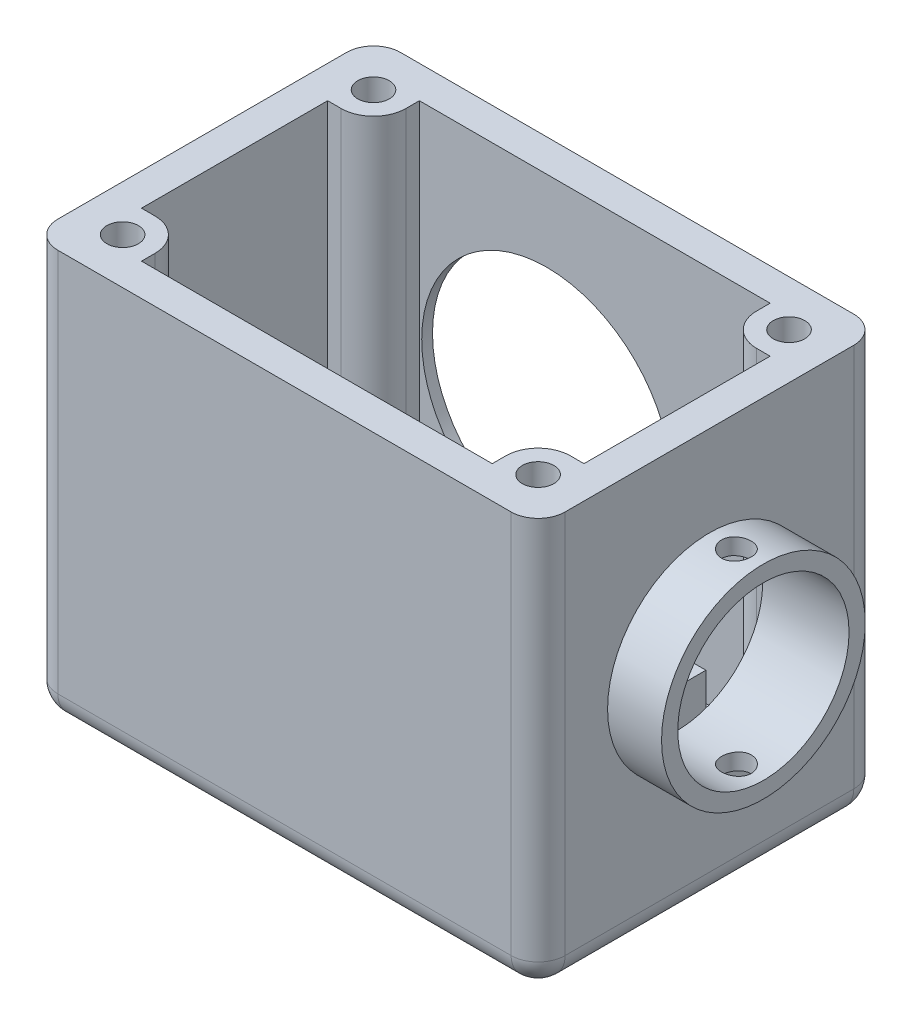
from build123d import *

# Parameters (mm, degrees)
SKETCH1_W                 = 94
SKETCH1_H                 = 63.5
BOSS_EXTRUDE1_DEPTH       = 76.2
SKETCH2_W                 = 82.000024
SKETCH2_H                 = 51.500024
CUT_EXTRUDE1_DEPTH        = 70.2
SKETCH7_R                 = 33
CUT_EXTRUDE4_DEPTH        = 4
SKETCH8_R                 = 12.55
CUT_EXTRUDE5_DEPTH        = 2
SKETCH15_W                = 72
SKETCH15_H                = 25
BOSS_EXTRUDE3_DEPTH       = 22
FILLET1_R                 = 5
BOSS_EXTRUDE4_DEPTH       = 70.2
F_1_0MM_DOWEL_HOLE2_D     = 5.85
F_1_0MM_DOWEL_HOLE2_DEPTH = 10.75
F_1_0MM_DOWEL_HOLE2_TIP   = 1.757517311
SKETCH49_R                = 15.875
CUT_EXTRUDE7_DEPTH        = 5.999988
BOSS_EXTRUDE5_START       = 10
SKETCH51_R                = 18.875
SKETCH51_R_2              = 15.875
BOSS_EXTRUDE5_DEPTH       = 10
SKETCH52_R                = 2.75
CUT_EXTRUDE8_DEPTH        = 124.940865436
SKETCH53_R                = 23.17
CUT_EXTRUDE9_DEPTH        = 1.999988
BRACKET_HOLES_D           = 4
BRACKET_HOLES_DEPTH       = 10.75
BRACKET_HOLES_TIP         = 1.201721238


with BuildPart() as part:
    # Sketch1 → Boss-Extrude1 (new body)
    with BuildSketch(Plane(origin=(0, 0, 0), x_dir=(1, 0, 0), z_dir=(0, 1, 0))):
        with Locations((47, 0)):
            Rectangle(SKETCH1_W, SKETCH1_H)
    extrude(amount=BOSS_EXTRUDE1_DEPTH)

    # Sketch2 → Cut-Extrude1 (cut)
    with BuildSketch(Plane(origin=(0, 76.2, 0), x_dir=(1, 0, 0), z_dir=(0, 1, 0))):
        with Locations((47, 0)):
            Rectangle(SKETCH2_W, SKETCH2_H)
    extrude(amount=-CUT_EXTRUDE1_DEPTH, mode=Mode.SUBTRACT)

    # Sketch7 → Cut-Extrude4 (cut)
    with BuildSketch(Plane(origin=(0, 0, -31.75), x_dir=(-1, 0, 0), z_dir=(0, 0, -1))):
        with Locations((-38.1, 38.1)):
            Circle(SKETCH7_R)
    extrude(amount=-CUT_EXTRUDE4_DEPTH, mode=Mode.SUBTRACT)

    # Sketch8 → Cut-Extrude5 (cut)
    with BuildSketch(Plane.XY.offset(-25.750012)):
        with Locations((38.1, 38.1)):
            Circle(SKETCH8_R)
    extrude(amount=-CUT_EXTRUDE5_DEPTH, mode=Mode.SUBTRACT)

    # Sketch15 → Boss-Extrude3 (add)
    with BuildSketch(Plane(origin=(0, 28, 0), x_dir=(1, 0, 0), z_dir=(0, 1, 0))):
        with Locations((48.25, -3.399988)):
            Rectangle(SKETCH15_W, SKETCH15_H)
    extrude(amount=-BOSS_EXTRUDE3_DEPTH)

    # Fillet1
    fillet1_edges = [part.edges().sort_by_distance(p)[0] for p in [
        (47, 0, -31.75),
        (94, 0, 0),
        (47, 0, 31.75),
        (0, 0, 0),
        (0, 38.1, -31.75),
        (94, 38.1, -31.75),
        (94, 38.1, 31.75),
        (0, 38.1, 31.75),
    ]]
    fillet(fillet1_edges, radius=FILLET1_R)

    # Sketch44 → Boss-Extrude4 (add)
    with BuildSketch(Plane(origin=(0, 76.2, 0), x_dir=(1, 0, 0), z_dir=(0, 1, 0))):
        with BuildLine():
            Line((8.499988, 17.250012), (5.999988, 17.250012))
            Line((5.999988, 17.250012), (5.999988, 25.750012))
            Line((5.999988, 25.750012), (14.499988, 25.750012))
            Line((14.499988, 25.750012), (14.499988, 23.250012))
            ThreePointArc((14.499988, 23.250012), (12.742628687, 19.007371313), (8.499988, 17.250012))
        make_face()
        with BuildLine():
            Line((8.499988, -17.250012), (5.999988, -17.250012))
            Line((5.999988, -17.250012), (5.999988, -25.750012))
            Line((5.999988, -25.750012), (14.499988, -25.750012))
            Line((14.499988, -25.750012), (14.499988, -23.250012))
            ThreePointArc((14.499988, -23.250012), (12.742628687, -19.007371313), (8.499988, -17.250012))
        make_face()
        with BuildLine():
            Line((79.500012, -23.250012), (79.500012, -25.750012))
            Line((79.500012, -25.750012), (88.000012, -25.750012))
            Line((88.000012, -25.750012), (88.000012, -17.250012))
            Line((88.000012, -17.250012), (85.500012, -17.250012))
            ThreePointArc((85.500012, -17.250012), (81.257371313, -19.007371313), (79.500012, -23.250012))
        make_face()
        with BuildLine():
            Line((79.500012, 23.250012), (79.500012, 25.750012))
            Line((79.500012, 25.750012), (88.000012, 25.750012))
            Line((88.000012, 25.750012), (88.000012, 17.250012))
            Line((88.000012, 17.250012), (85.500012, 17.250012))
            ThreePointArc((85.500012, 17.250012), (81.257371313, 19.007371313), (79.500012, 23.250012))
        make_face()
    extrude(amount=-BOSS_EXTRUDE4_DEPTH)

    # Ø1.0mm Dowel Hole2
    with Locations(Plane(origin=(0, 76.2, 0), x_dir=(1, 0, 0), z_dir=(0, 1, 0))):
        with Locations((8.499988, 23.250012), (8.499988, -23.250012), (85.500012, -23.250012), (85.500012, 23.250012)):
            Hole(F_1_0MM_DOWEL_HOLE2_D / 2, depth=F_1_0MM_DOWEL_HOLE2_DEPTH)
            with Locations((0, 0, -(F_1_0MM_DOWEL_HOLE2_DEPTH + F_1_0MM_DOWEL_HOLE2_TIP / 2))):  # 118° drill point
                Cone(0, F_1_0MM_DOWEL_HOLE2_D / 2, F_1_0MM_DOWEL_HOLE2_TIP, mode=Mode.SUBTRACT)

    # Sketch49 → Cut-Extrude7 (cut)
    with BuildSketch(Plane(origin=(94, 0, 0), x_dir=(0, 0, -1), z_dir=(1, 0, 0))):
        with Locations((0, 40.6)):
            Circle(SKETCH49_R)
    extrude(amount=-CUT_EXTRUDE7_DEPTH, mode=Mode.SUBTRACT)

    # Sketch51 → Boss-Extrude5 (add)
    with BuildSketch(Plane(origin=(94, 0, 0), x_dir=(0, 0, -1), z_dir=(1, 0, 0)).offset(BOSS_EXTRUDE5_START)):
        with Locations(Location((0, 40.6, 0), (0, 0, 180))):
            Circle(SKETCH51_R)
        with Locations((0, 40.6)):
            Circle(SKETCH51_R_2, mode=Mode.SUBTRACT)
    extrude(amount=-BOSS_EXTRUDE5_DEPTH)

    # Sketch52 → Cut-Extrude8 (cut, through all)
    with BuildSketch(Plane(origin=(0, 59.475, 0), x_dir=(-1, 0, 0), z_dir=(0, 1, 0))):
        with Locations(Location((-99, 0, 0), (0, 0, 90))):
            Circle(SKETCH52_R)
    extrude(amount=-CUT_EXTRUDE8_DEPTH, mode=Mode.SUBTRACT)

    # Sketch53 → Cut-Extrude9 (cut)
    with BuildSketch(Plane(origin=(0, 0, -27.75), x_dir=(-1, 0, 0), z_dir=(0, 0, -1))):
        with Locations((-38.1, 38.1)):
            Circle(SKETCH53_R)
    extrude(amount=-CUT_EXTRUDE9_DEPTH, mode=Mode.SUBTRACT)

    # Bracket Holes
    with Locations(Plane(origin=(0, 28, 0), x_dir=(1, 0, 0), z_dir=(0, 1, 0))):
        with Locations((15.75, 5.100012), (15.75, -2.899988), (80.75, -2.899988), (80.75, 5.100012)):
            Hole(BRACKET_HOLES_D / 2, depth=BRACKET_HOLES_DEPTH)
            with Locations((0, 0, -(BRACKET_HOLES_DEPTH + BRACKET_HOLES_TIP / 2))):  # 118° drill point
                Cone(0, BRACKET_HOLES_D / 2, BRACKET_HOLES_TIP, mode=Mode.SUBTRACT)


solid = part.part
